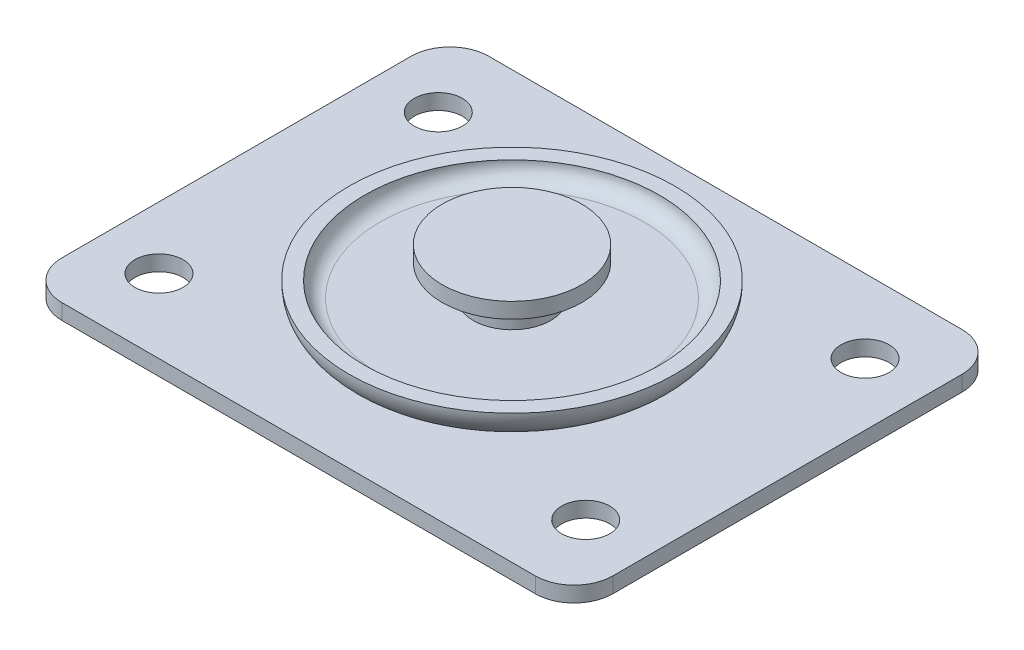
from build123d import *

# Parameters (mm, degrees)
SKETCH_2_W              = 71
SKETCH_2_H              = 55
EXTRUDE_1_DEPTH         = 2
HOLE_WIZARD_6_2_6_2_1_D = 6.2
FILLET_1_R              = 5


with BuildPart() as part:
    # 草图1 → 旋转1 (revolve)
    with BuildSketch(Plane(origin=(0, 0, 0), x_dir=(-1, 0, 0), z_dir=(0, 0, -1)), mode=Mode.PRIVATE) as revolve_1_sk:
        with BuildLine():
            Line((-17, -2), (0, -2))
            Line((0, -2), (0, 0))
            Line((0, 0), (-17, 0))
            ThreePointArc((-17, 0), (-18.414213562, 0.585786438), (-19, 2))
            Line((-19, 2), (-21, 2))
            ThreePointArc((-21, 2), (-19.828427125, -0.828427125), (-17, -2))
        make_face()
    revolve(revolve_1_sk.sketch.rotate(Axis((0, -2.005, 0), (0, 1, 0)), 270), axis=Axis((0, -2.005, 0), (0, 1, 0)))

    # 草图2 → 凸台-拉伸1 (add)
    with BuildSketch(Plane(origin=(0, -2, 0), x_dir=(1, 0, 0), z_dir=(0, 1, 0))):
        Rectangle(SKETCH_2_W, SKETCH_2_H)
    extrude(amount=-EXTRUDE_1_DEPTH)

    # 草图3 → 旋转2 (revolve)
    with BuildSketch(Plane(origin=(0, 0, 0), x_dir=(-1, 0, 0), z_dir=(0, 0, -1)), mode=Mode.PRIVATE) as revolve_2_sk:
        Polygon((-5, 0), (0, 0), (0, 6), (-9, 6), (-9, 4), (-5, 4), align=None)
    revolve(revolve_2_sk.sketch.rotate(Axis((0, 0, 0), (0, 1, 0)), 270), axis=Axis((0, 0, 0), (0, 1, 0)))

    # Ø6.2 (6.2) 直径孔1 (through all)
    with Locations(Plane(origin=(0, -2, 0), x_dir=(1, 0, 0), z_dir=(0, 1, 0))):
        with Locations((-27.5, 18), (-27.5, -18), (27.5, -18), (27.5, 18)):
            Hole(HOLE_WIZARD_6_2_6_2_1_D / 2)

    # 圆角1
    fillet_1_edges = [part.edges().sort_by_distance(p)[0] for p in [
        (35.5, -3, -27.5),
        (35.5, -3, 27.5),
        (-35.5, -3, 27.5),
        (-35.5, -3, -27.5),
    ]]
    fillet(fillet_1_edges, radius=FILLET_1_R)


solid = part.part
